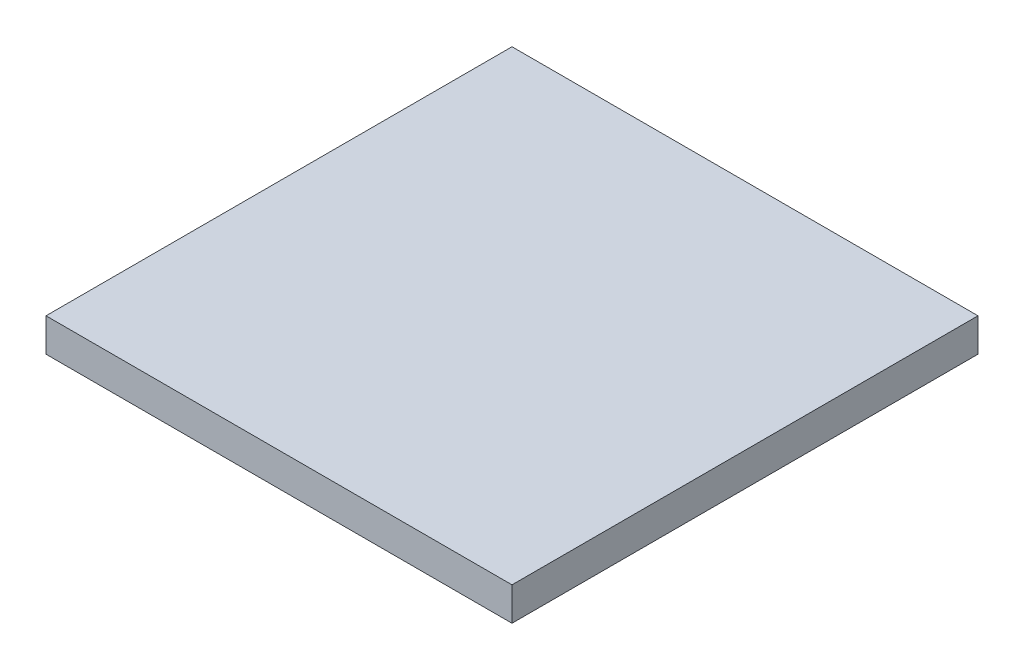
from build123d import *

# Parameters (mm, degrees)
SKETCH_1_W      = 4.2
SKETCH_1_H      = 4.2
EXTRUDE_1_DEPTH = 0.3


with BuildPart() as part:
    # 草图1 → 凸台-拉伸1 (new body)
    with BuildSketch(Plane(origin=(0, 0, 0), x_dir=(1, 0, 0), z_dir=(0, 1, 0))):
        Rectangle(SKETCH_1_W, SKETCH_1_H)
    extrude(amount=EXTRUDE_1_DEPTH)


solid = part.part
